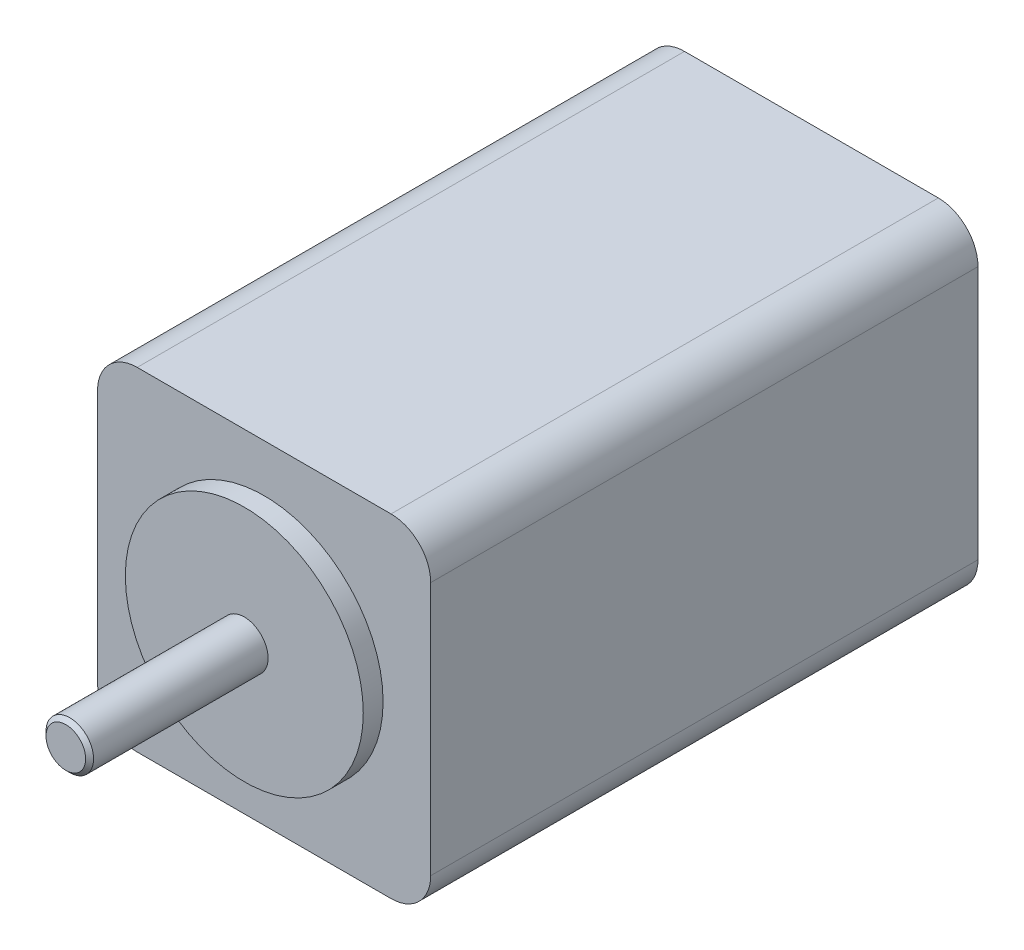
from build123d import *

# Parameters (mm, degrees)
SKETCH1_W           = 42
SKETCH1_H           = 42
BOSS_EXTRUDE1_DEPTH = 5
FILLET1_R           = 5
SKETCH2_R           = 15
BOSS_EXTRUDE2_DEPTH = 2.5
SKETCH3_R           = 3
BOSS_EXTRUDE3_DEPTH = 22.5
BOSS_EXTRUDE5_DEPTH = 64
CHAMFER1_SIZE       = 0.5


with BuildPart() as part:
    # Sketch1 → Boss-Extrude1 (new body)
    with BuildSketch(Plane.XY):
        Rectangle(SKETCH1_W, SKETCH1_H)
    extrude(amount=BOSS_EXTRUDE1_DEPTH)

    # Fillet1
    fillet1_edges = [part.edges().sort_by_distance(p)[0] for p in [
        (21, -21, 2.5),
        (-21, -21, 2.5),
        (-21, 21, 2.5),
        (21, 21, 2.5),
    ]]
    fillet(fillet1_edges, radius=FILLET1_R)

    # Sketch2 → Boss-Extrude2 (add)
    with BuildSketch(Plane.XY.offset(5)):
        Circle(SKETCH2_R)
    extrude(amount=BOSS_EXTRUDE2_DEPTH)

    # Sketch3 → Boss-Extrude3 (add)
    with BuildSketch(Plane.XY.offset(7.5)):
        with Locations(Location((0, 0, 0), (0, 0, 180))):
            Circle(SKETCH3_R)
    extrude(amount=BOSS_EXTRUDE3_DEPTH)

    # Sketch4 → Boss-Extrude5 (add)
    with BuildSketch(Plane(origin=(0, 0, 0), x_dir=(-1, 0, 0), z_dir=(0, 0, -1))):
        with BuildLine():
            Line((-21, -16), (-21, 16))
            ThreePointArc((-21, 16), (-19.535533906, 19.535533906), (-16, 21))
            Line((-16, 21), (16, 21))
            ThreePointArc((16, 21), (19.535533906, 19.535533906), (21, 16))
            Line((21, 16), (21, -16))
            ThreePointArc((21, -16), (19.535533906, -19.535533906), (16, -21))
            Line((16, -21), (-16, -21))
            ThreePointArc((-16, -21), (-19.535533906, -19.535533906), (-21, -16))
        make_face()
    extrude(amount=BOSS_EXTRUDE5_DEPTH)

    # Chamfer1
    chamfer1_edges = [part.edges().sort_by_distance(p)[0] for p in [
        (3, 0, 30),
    ]]
    chamfer(chamfer1_edges, length=CHAMFER1_SIZE)


solid = part.part
